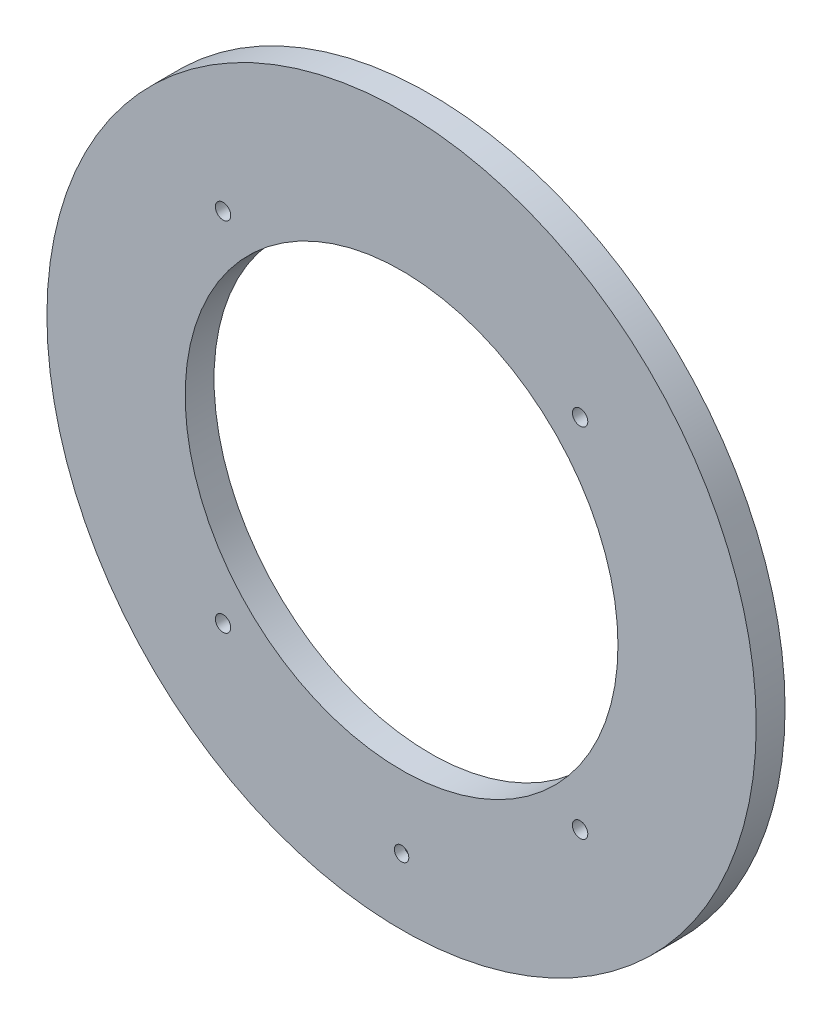
from build123d import *

# Parameters (mm, degrees)
SCHIZZO1_R                   = 147.5
SCHIZZO1_R_2                 = 90
ESTRUSIONE_ESTRUSIONE1_DEPTH = 12
TAGLIO_ESTRUSIONE1_DEPTH     = 8
SCHIZZO10_R                  = 3
TAGLIO_ESTRUSIONE2_DEPTH     = 4
RIPETIZIONECIRCOLARE3_COUNT  = 4


with BuildPart() as part:
    # Schizzo1 → Estrusione-Estrusione1 (new body)
    with BuildSketch(Plane.XY):
        Circle(SCHIZZO1_R)
        Circle(SCHIZZO1_R_2, mode=Mode.SUBTRACT)
    extrude(amount=ESTRUSIONE_ESTRUSIONE1_DEPTH)

    # Schizzo3 → Taglio-Estrusione1 (cut)
    with BuildSketch(Plane(origin=(0, 0, 0), x_dir=(-1, 0, 0), z_dir=(0, 0, -1))):
        with BuildLine():
            ThreePointArc((83.562389259, 99.585777605), (69.474068731, 98.353209271), (70.706637066, 84.264888743))
            ThreePointArc((70.706637066, 84.264888743), (67.682853372, -86.712348368), (-98.91169794, -48.12978299))
            ThreePointArc((-98.91169794, -48.12978299), (-112.279105297, -43.513245268), (-116.89564302, -56.880652625))
            ThreePointArc((-116.89564302, -56.880652625), (79.988826712, -102.478229889), (83.562389259, 99.585777605))
        make_face()
    extrude(amount=-TAGLIO_ESTRUSIONE1_DEPTH, mode=Mode.SUBTRACT)

    # Schizzo10 → Taglio-Estrusione2 (cut)
    with BuildSketch(Plane(origin=(0, 0, 8), x_dir=(-1, 0, 0), z_dir=(0, 0, -1))):
        with Locations((0, -120)):
            Circle(SCHIZZO10_R)
    extrude(amount=-TAGLIO_ESTRUSIONE2_DEPTH, mode=Mode.SUBTRACT)

    # Schizzo13 → Foro per Vite M6-1 (revolve, cut)
    with BuildSketch(Plane(origin=(-74.246212025, -74.246212025, 12), x_dir=(0, -1, 0), z_dir=(1, 0, 0))):
        Polygon((0, 0), (0, 7.922753981), (3.2, 6), (3.2, 0), align=None)
    foro_per_vite_m6_1 = revolve(axis=Axis((-74.246212025, -74.246212025, 18.35), (0, 0, -1)), mode=Mode.SUBTRACT)

    # RipetizioneCircolare3: Foro per Vite M6-1 ×4 about axis
    ripetizionecircolare3_axis = Axis((0, 0, 0), (0, 0, 1))
    for i in range(1, RIPETIZIONECIRCOLARE3_COUNT):
        add(foro_per_vite_m6_1.rotate(ripetizionecircolare3_axis, i * 360 / RIPETIZIONECIRCOLARE3_COUNT), mode=Mode.SUBTRACT)


solid = part.part
